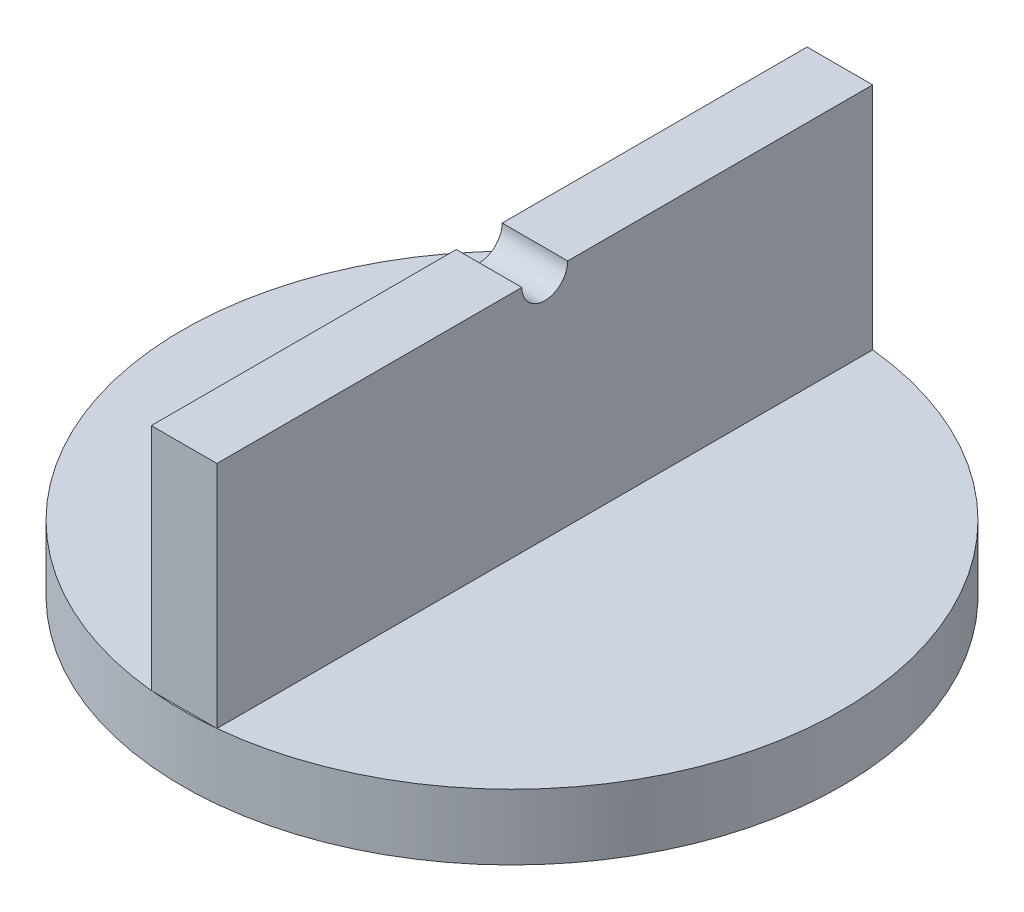
from build123d import *

# Parameters (mm, degrees)
BOSS_EXTRUDE1_DEPTH = 5
SKETCH2_R           = 50.249378106
BOSS_EXTRUDE2_DEPTH = 10


with BuildPart() as part:
    # Sketch1 → Boss-Extrude1 (new, symmetric)
    with BuildSketch(Plane(origin=(0, 0, 0), x_dir=(0, 0, -1), z_dir=(1, 0, 0))):
        with BuildLine():
            Line((-3.5, 17.5), (-50, 17.5))
            Line((-50, 17.5), (-50, -17.5))
            Line((-50, -17.5), (50, -17.5))
            Line((50, -17.5), (50, 17.5))
            Line((50, 17.5), (3.5, 17.5))
            ThreePointArc((3.5, 17.5), (0, 14), (-3.5, 17.5))
        make_face()
    extrude(amount=BOSS_EXTRUDE1_DEPTH, both=True)

    # Sketch2 → Boss-Extrude2 (add)
    with BuildSketch(Plane.XZ.offset(17.5)):
        with Locations(Location((0, 0, 0), (0, 0, 95.710593137))):
            Circle(SKETCH2_R)
    extrude(amount=BOSS_EXTRUDE2_DEPTH)


solid = part.part
